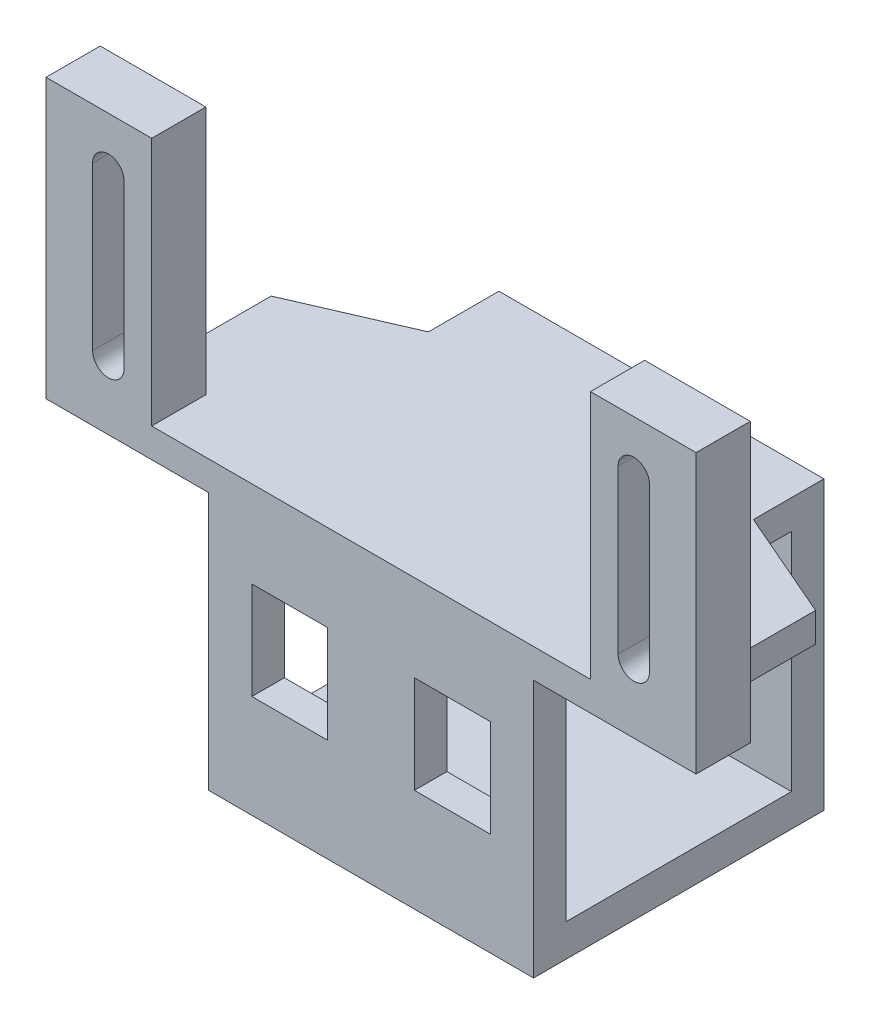
from build123d import *

# Parameters (mm, degrees)
SKETCH_1_W          = 26.8
SKETCH_1_H          = 28
SKETCH_1_W_2        = 20.8
SKETCH_1_H_2        = 22
EXTRUDE_1_DEPTH     = 30
SKETCH_2_W          = 3
SKETCH_2_H          = 5
CUT_EXTRUDE_1_DEPTH = 30
SKETCH_3_W          = 20.8
SKETCH_3_H          = 1.2
EXTRUDE_2_DEPTH     = 30
SKETCH_4_W          = 26.962863122
SKETCH_4_H          = 1.5
CUT_EXTRUDE_2_DEPTH = 30
SKETCH_5_W          = 7
SKETCH_5_H          = 9
SKETCH_5_W_2        = 3
SKETCH_5_H_2        = 5
CUT_EXTRUDE_3_DEPTH = 47.588517899
EXTRUDE_3_DEPTH     = 5
EXTRUDE_4_DEPTH     = 2.7


with BuildPart() as part:
    # 草图1 → 凸台-拉伸1 (new body)
    with BuildSketch(Plane(origin=(0, 0, 0), x_dir=(0, 0, -1), z_dir=(1, 0, 0))):
        with Locations((10.4, 11)):
            Rectangle(SKETCH_1_W, SKETCH_1_H)
        with Locations((10.4, 11)):
            Rectangle(SKETCH_1_W_2, SKETCH_1_H_2, mode=Mode.SUBTRACT)
    extrude(amount=EXTRUDE_1_DEPTH)

    # 草图2 → 切除-拉伸1 (cut)
    with BuildSketch(Plane(origin=(0, 0, -23.8), x_dir=(-1, 0, 0), z_dir=(0, 0, -1))):
        with Locations((-22.5, 11)):
            Rectangle(SKETCH_2_W, SKETCH_2_H)
        with Locations((-7.5, 11)):
            Rectangle(SKETCH_2_W, SKETCH_2_H)
    extrude(amount=-CUT_EXTRUDE_1_DEPTH, mode=Mode.SUBTRACT)

    # 草图3 → 凸台-拉伸2 (add)
    with BuildSketch(Plane.ZY):
        with Locations((-10.4, 21.4)):
            Rectangle(SKETCH_3_W, SKETCH_3_H)
    extrude(amount=-EXTRUDE_2_DEPTH)

    # 草图4 → 切除-拉伸2 (cut)
    with BuildSketch(Plane.ZY):
        with Locations((-10.318568439, 24.25)):
            Rectangle(SKETCH_4_W, SKETCH_4_H)
    extrude(amount=-CUT_EXTRUDE_2_DEPTH, mode=Mode.SUBTRACT)

    # 草图5 → 切除-拉伸3 (cut, through all)
    # profile 1 of 2: a face of its own
    with BuildSketch(Plane(origin=(0, 0, -23.8), x_dir=(-1, 0, 0), z_dir=(0, 0, -1))):
        with Locations((-22.5, 11)):
            Rectangle(SKETCH_5_W, SKETCH_5_H)
        with Locations((-22.5, 11)):
            Rectangle(SKETCH_5_W_2, SKETCH_5_H_2, mode=Mode.SUBTRACT)
    # profile 2 of 2: a face of its own
    with BuildSketch(Plane(origin=(0, 0, -23.8), x_dir=(-1, 0, 0), z_dir=(0, 0, -1))):
        with Locations((-7.5, 11)):
            Rectangle(SKETCH_5_W, SKETCH_5_H)
        with Locations((-7.5, 11)):
            Rectangle(SKETCH_5_W_2, SKETCH_5_H_2, mode=Mode.SUBTRACT)
    extrude(amount=-CUT_EXTRUDE_3_DEPTH, mode=Mode.SUBTRACT)

    # 草图6 → 凸台-拉伸3 (add)
    with BuildSketch(Plane.XY.offset(3)):
        Polygon((45, 20.8), (45, 46.5), (35.25, 46.5), (35.25, 23.5), (-5.25, 23.5), (-5.25, 46.5), (-15, 46.5), (-15, 20.8), align=None)
        with BuildLine():
            Line((-7.8, 41.8), (-7.8, 26.8))
            ThreePointArc((-7.8, 26.8), (-9.25, 25.35), (-10.7, 26.8))
            Line((-10.7, 26.8), (-10.7, 41.8))
            ThreePointArc((-10.7, 41.8), (-9.25, 43.25), (-7.8, 41.8))
        make_face(mode=Mode.SUBTRACT)
        with BuildLine():
            Line((37.8, 41.8), (37.8, 26.8))
            ThreePointArc((37.8, 26.8), (39.25, 25.35), (40.7, 26.8))
            Line((40.7, 26.8), (40.7, 41.8))
            ThreePointArc((40.7, 41.8), (39.25, 43.25), (37.8, 41.8))
        make_face(mode=Mode.SUBTRACT)
    extrude(amount=-EXTRUDE_3_DEPTH)

    # 草图7 → 凸台-拉伸4 (add)
    with BuildSketch(Plane(origin=(0, 23.5, 0), x_dir=(1, 0, 0), z_dir=(0, 1, 0))):
        Polygon((-10.125, 2), (-10.125, 12.9), (15, 23.8), (40.125, 12.9), (40.125, 2), align=None)
    extrude(amount=-EXTRUDE_4_DEPTH)


solid = part.part
